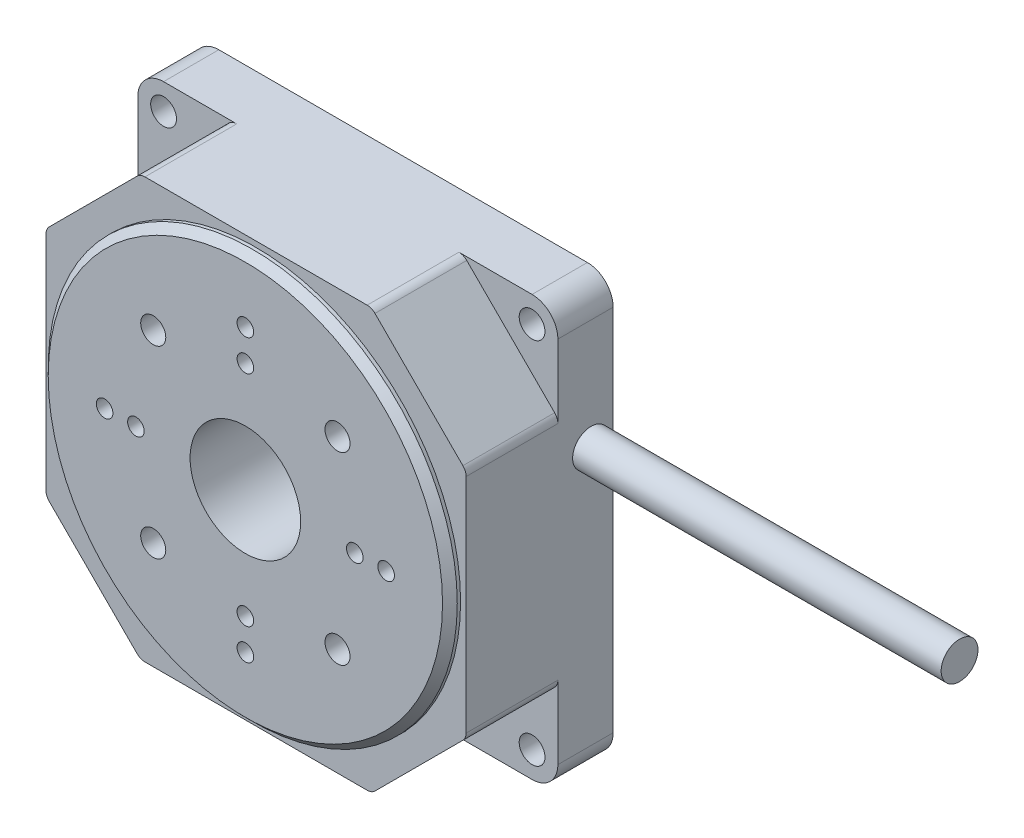
from build123d import *

# Parameters (mm, degrees)
SKETCH1_R           = 3.5
BOSS_EXTRUDE1_DEPTH = 15
BOSS_EXTRUDE2_DEPTH = 24.9
FILLET1_R           = 3
SKETCH3_R           = 5
BOSS_EXTRUDE3_DEPTH = 100
SKETCH4_R           = 55.5
BOSS_EXTRUDE4_DEPTH = 2.9
CHAMFER1_SIZE       = 2
SKETCH5_R           = 3.4
SKETCH5_R_2         = 2.25
CUT_EXTRUDE1_DEPTH  = 5
CUT_EXTRUDE2_REACH  = 174.423
SKETCH6_R           = 15
SKETCH7_R           = 3.4
CUT_EXTRUDE3_DEPTH  = 6


with BuildPart() as part:
    # Sketch1 → Boss-Extrude1 (new body)
    with BuildSketch(Plane.XY):
        with BuildLine():
            Line((-50, 57), (50, 57))
            ThreePointArc((50, 57), (54.949747468, 54.949747468), (57, 50))
            Line((57, 50), (57, -50))
            ThreePointArc((57, -50), (54.949747468, -54.949747468), (50, -57))
            Line((50, -57), (-50, -57))
            ThreePointArc((-50, -57), (-54.949747468, -54.949747468), (-57, -50))
            Line((-57, -50), (-57, 50))
            ThreePointArc((-57, 50), (-54.949747468, 54.949747468), (-50, 57))
        make_face()
        with Locations((50, 50)):
            Circle(SKETCH1_R, mode=Mode.SUBTRACT)
        with Locations(Location((-50, 50, 0), (0, 0, 180))):
            Circle(SKETCH1_R, mode=Mode.SUBTRACT)
        with Locations(Location((50, -50, 0), (0, 0, 180))):
            Circle(SKETCH1_R, mode=Mode.SUBTRACT)
        with Locations((-50, -50)):
            Circle(SKETCH1_R, mode=Mode.SUBTRACT)
    extrude(amount=BOSS_EXTRUDE1_DEPTH)

    # Sketch2 → Boss-Extrude2 (add)
    with BuildSketch(Plane.XY.offset(15)):
        Polygon((31.388347648, 57), (57, 31.388347648), (57, -31.388347648), (31.388347648, -57), (-31.388347648, -57), (-57, -31.388347648), (-57, 31.388347648), (-31.388347648, 57), align=None)
    extrude(amount=BOSS_EXTRUDE2_DEPTH)

    # Fillet1
    fillet1_edges = [part.edges().sort_by_distance(p)[0] for p in [
        (31.388347648, 57, 27.45),
        (-31.388347648, 57, 27.45),
        (-57, 31.388347648, 27.45),
        (-57, -31.388347648, 27.45),
        (-31.388347648, -57, 27.45),
        (31.388347648, -57, 27.45),
        (57, -31.388347648, 27.45),
        (57, 31.388347648, 27.45),
    ]]
    fillet(fillet1_edges, radius=FILLET1_R)

    # Sketch3 → Boss-Extrude3 (add)
    with BuildSketch(Plane(origin=(57, 0, 0), x_dir=(0, 0, -1), z_dir=(1, 0, 0))):
        with Locations(Location((-6, 20, 0), (0, 0, 270))):
            Circle(SKETCH3_R)
    extrude(amount=BOSS_EXTRUDE3_DEPTH)

    # Sketch4 → Boss-Extrude4 (add)
    with BuildSketch(Plane.XY.offset(39.9)):
        Circle(SKETCH4_R)
    extrude(amount=BOSS_EXTRUDE4_DEPTH)

    # Chamfer1
    chamfer1_edges = [part.edges().sort_by_distance(p)[0] for p in [
        (-55.5, 0, 42.8),
    ]]
    chamfer(chamfer1_edges, length=CHAMFER1_SIZE)

    # Sketch5 → Cut-Extrude1 (cut)
    with BuildSketch(Plane.XY.offset(42.8)):
        with Locations((25, 25)):
            Circle(SKETCH5_R)
        with Locations((0, 38.2)):
            Circle(SKETCH5_R_2)
        with Locations((0, 29.7)):
            Circle(SKETCH5_R_2)
        with Locations((38.2, 0)):
            Circle(SKETCH5_R_2)
        with Locations((29.7, 0)):
            Circle(SKETCH5_R_2)
        with Locations((25, -25)):
            Circle(SKETCH5_R)
        with Locations((0, -38.2)):
            Circle(SKETCH5_R_2)
        with Locations((0, -29.7)):
            Circle(SKETCH5_R_2)
        with Locations((-25, -25)):
            Circle(SKETCH5_R)
        with Locations((-38.2, 0)):
            Circle(SKETCH5_R_2)
        with Locations((-29.7, 0)):
            Circle(SKETCH5_R_2)
        with Locations((-25, 25)):
            Circle(SKETCH5_R)
    extrude(amount=-CUT_EXTRUDE1_DEPTH, mode=Mode.SUBTRACT)

    # Sketch6 → Cut-Extrude2 (cut, up to next)
    with BuildSketch(Plane.XY.offset(42.8), mode=Mode.PRIVATE) as cut_extrude2_sk1:
        Circle(SKETCH6_R)
    cut_extrude2_tool1 = extrude(cut_extrude2_sk1.sketch, amount=-CUT_EXTRUDE2_REACH, mode=Mode.PRIVATE) & part.part
    add(cut_extrude2_tool1.solids().sort_by_distance((0, 0, 42.8))[0], mode=Mode.SUBTRACT)

    # Sketch7 → Cut-Extrude3 (cut)
    with BuildSketch(Plane.XZ.offset(57)):
        with Locations(Location((-25.4, 31.3, 0), (0, 0, 270))):
            Circle(SKETCH7_R)
        with Locations(Location((-25.4, 5.9, 0), (0, 0, 270))):
            Circle(SKETCH7_R)
        with Locations(Location((25.4, 5.9, 0), (0, 0, 90))):
            Circle(SKETCH7_R)
        with Locations(Location((25.4, 31.3, 0), (0, 0, 90))):
            Circle(SKETCH7_R)
    extrude(amount=-CUT_EXTRUDE3_DEPTH, mode=Mode.SUBTRACT)


solid = part.part
